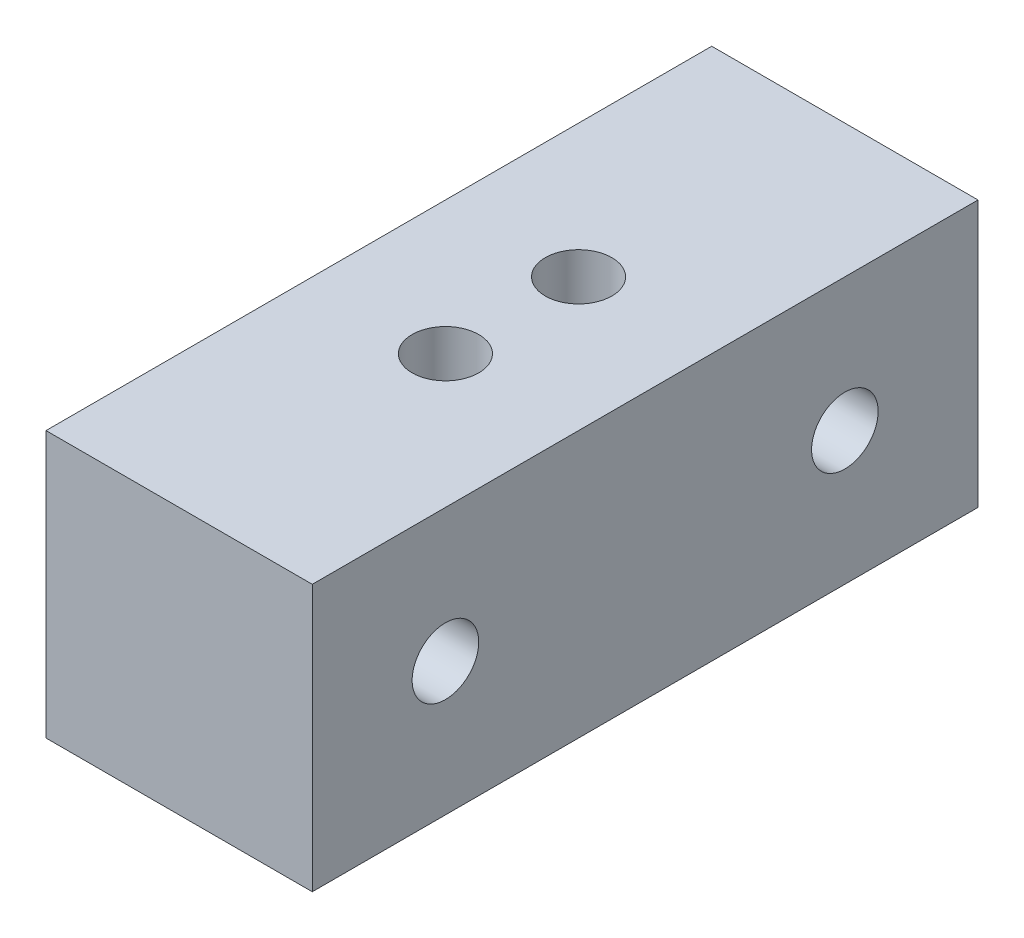
from build123d import *

# Parameters (mm, degrees)
SKETCH_1_W          = 20
SKETCH_1_H          = 20
EXTRUDE_1_DEPTH     = 50
SKETCH_2_R          = 2.5
CUT_EXTRUDE_1_DEPTH = 14
SKETCH_3_R          = 2.5
CUT_EXTRUDE_2_DEPTH = 14


with BuildPart() as part:
    # 草图1 → 凸台-拉伸1 (new body)
    with BuildSketch(Plane.XY):
        with Locations((10, 10)):
            Rectangle(SKETCH_1_W, SKETCH_1_H)
    extrude(amount=EXTRUDE_1_DEPTH)

    # 草图2 → 切除-拉伸1 (cut)
    with BuildSketch(Plane(origin=(20, 0, 0), x_dir=(0, 0, -1), z_dir=(1, 0, 0))):
        with Locations((-10, 10)):
            Circle(SKETCH_2_R)
        with Locations((-40, 10)):
            Circle(SKETCH_2_R)
    extrude(amount=-CUT_EXTRUDE_1_DEPTH, mode=Mode.SUBTRACT)

    # 草图3 → 切除-拉伸2 (cut)
    with BuildSketch(Plane(origin=(0, 20, 0), x_dir=(1, 0, 0), z_dir=(0, 1, 0))):
        with Locations(Location((10, -20, 0), (0, 0, 270))):
            Circle(SKETCH_3_R)
        with Locations(Location((10, -30, 0), (0, 0, 270))):
            Circle(SKETCH_3_R)
    extrude(amount=-CUT_EXTRUDE_2_DEPTH, mode=Mode.SUBTRACT)


solid = part.part
